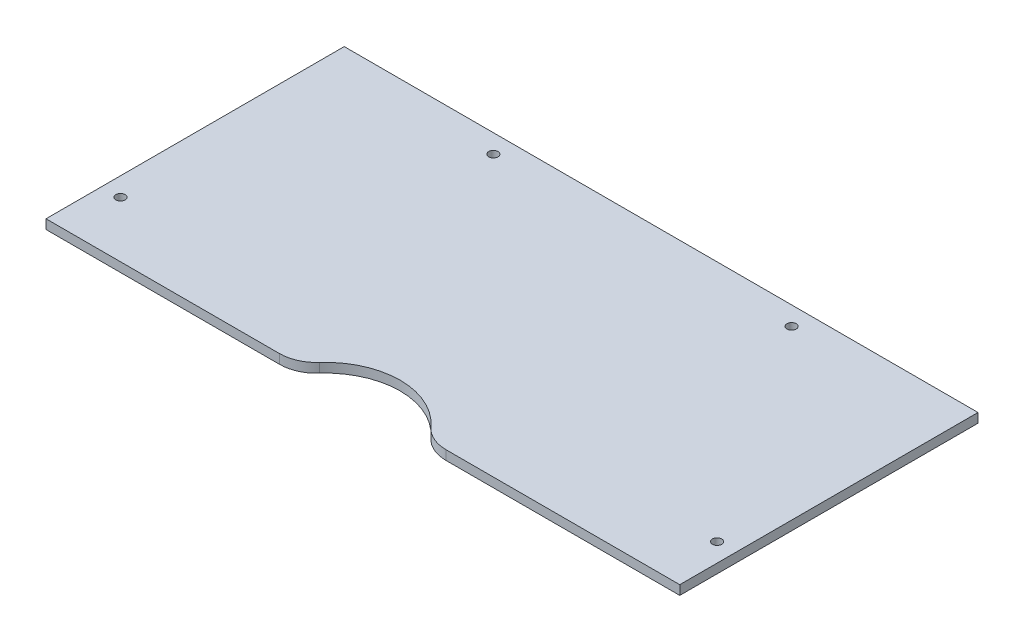
from build123d import *

# Parameters (mm, degrees)
BOSS_EXTRUDE1_DEPTH = 3.175
FILLET1_R           = 12.7
SKETCH2_R           = 1.5875
CUT_EXTRUDE1_DEPTH  = 315.453256661


with BuildPart() as part:
    # Sketch1 → Boss-Extrude1 (new body)
    with BuildSketch(Plane(origin=(0, 0, 0), x_dir=(1, 0, 0), z_dir=(0, 1, 0))):
        with BuildLine():
            Line((0, 228.6), (0, 127))
            Line((0, 127), (85.952954744, 127))
            ThreePointArc((85.952954744, 127), (107.95, 139.7), (129.947045256, 127))
            Line((129.947045256, 127), (215.9, 127))
            Line((215.9, 127), (215.9, 228.6))
            Line((215.9, 228.6), (0, 228.6))
        make_face()
    extrude(amount=BOSS_EXTRUDE1_DEPTH)

    # Fillet1
    fillet1_edges = [part.edges().sort_by_distance(p)[0] for p in [
        (85.952954744, 1.5875, -127),
        (129.947045256, 1.5875, -127),
    ]]
    fillet(fillet1_edges, radius=FILLET1_R)

    # Sketch2 → Cut-Extrude1 (cut, through all)
    with BuildSketch(Plane(origin=(0, 3.175, 0), x_dir=(1, 0, 0), z_dir=(0, 1, 0))):
        with Locations(Location((6.35, 146.05, 0), (0, 0, 270))):
            Circle(SKETCH2_R)
        with Locations(Location((57.15, 222.25, 0), (0, 0, 270))):
            Circle(SKETCH2_R)
        with Locations(Location((158.75, 222.25, 0), (0, 0, 270))):
            Circle(SKETCH2_R)
        with Locations(Location((209.55, 146.05, 0), (0, 0, 270))):
            Circle(SKETCH2_R)
    extrude(amount=-CUT_EXTRUDE1_DEPTH, mode=Mode.SUBTRACT)


solid = part.part
